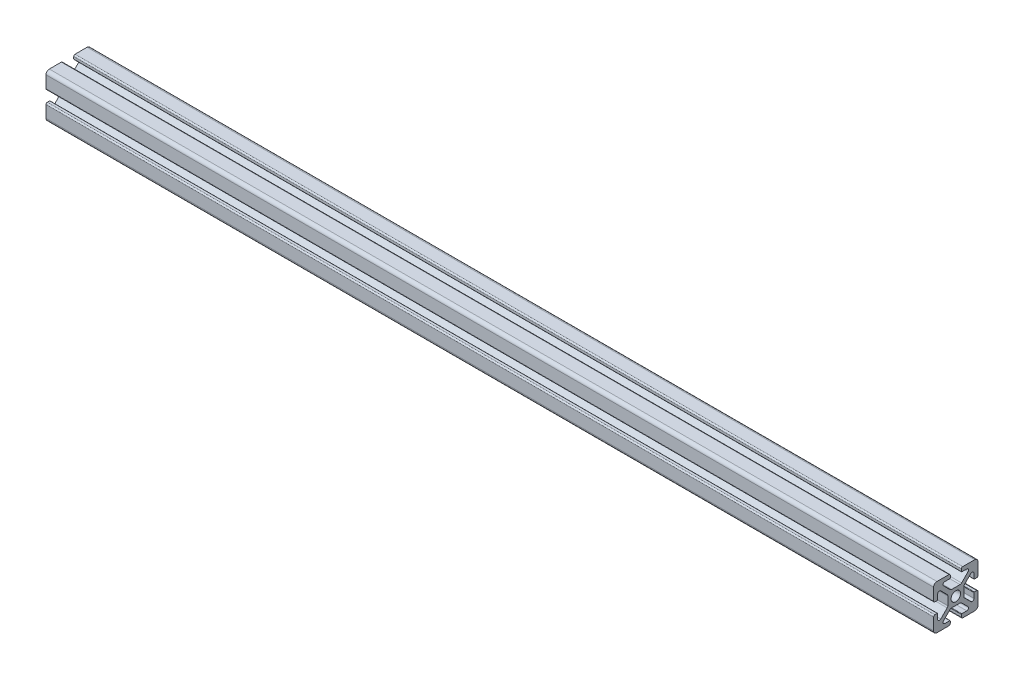
from build123d import *

# Parameters (mm, degrees)
BOSS_EXTRUDE1_DEPTH      = 200
BOSS_EXTRUDE1_DEPTH_BACK = 200


with BuildPart() as part:
    # Sketch3 → Boss-Extrude1 (new, two sides: drawn at the far end of the back side and taken through both)
    with BuildSketch(Plane(origin=(0, 0, 0), x_dir=(0, 0, -1), z_dir=(1, 0, 0)).offset(-BOSS_EXTRUDE1_DEPTH_BACK)):
        with BuildLine():
            Line((-5.515685425, 6.807463915), (-2.601114729, 3.892893219))
            ThreePointArc((-2.601114729, 3.892893219), (-2.27669138, 3.676120467), (-1.894007948, 3.6))
            Line((-1.894007948, 3.6), (0, 3.6))
            Line((0, 3.6), (0, 2.15))
            ThreePointArc((0, 2.15), (-1.52027958, 1.52027958), (-2.15, 0))
            Line((-2.15, 0), (-3.6, 0))
            Line((-3.6, 0), (-3.6, 1.894007948))
            ThreePointArc((-3.6, 1.894007948), (-3.676120467, 2.27669138), (-3.892893219, 2.601114729))
            Line((-3.892893219, 2.601114729), (-6.807463915, 5.515685425))
            ThreePointArc((-6.807463915, 5.515685425), (-7.679296086, 5.689103626), (-8.17314934, 4.95))
            Line((-8.17314934, 4.95), (-8.17314934, 2.7))
            ThreePointArc((-8.17314934, 2.7), (-8.231727984, 2.558578644), (-8.37314934, 2.5))
            Line((-8.37314934, 2.5), (-9.4, 2.5))
            ThreePointArc((-9.4, 2.5), (-9.824264069, 2.675735931), (-10, 3.1))
            Line((-10, 3.1), (-10, 8.5))
            ThreePointArc((-10, 8.5), (-9.560660172, 9.560660172), (-8.5, 10))
            Line((-8.5, 10), (-3.1, 10))
            ThreePointArc((-3.1, 10), (-2.675735931, 9.824264069), (-2.5, 9.4))
            Line((-2.5, 9.4), (-2.5, 8.37314934))
            ThreePointArc((-2.5, 8.37314934), (-2.558578644, 8.231727984), (-2.7, 8.17314934))
            Line((-2.7, 8.17314934), (-4.95, 8.17314934))
            ThreePointArc((-4.95, 8.17314934), (-5.689103626, 7.679296086), (-5.515685425, 6.807463915))
        make_face()
    extrude(amount=BOSS_EXTRUDE1_DEPTH + BOSS_EXTRUDE1_DEPTH_BACK)

    # Mirror1: part across plane


with BuildPart() as part_1:
    add(part.part)
    add(part.part.mirror(Plane.ZX))

    # Mirror2: part across plane


with BuildPart() as part_2:
    add(part_1.part)
    add(part_1.part.mirror(Plane.XY))


solid = part_2.part
